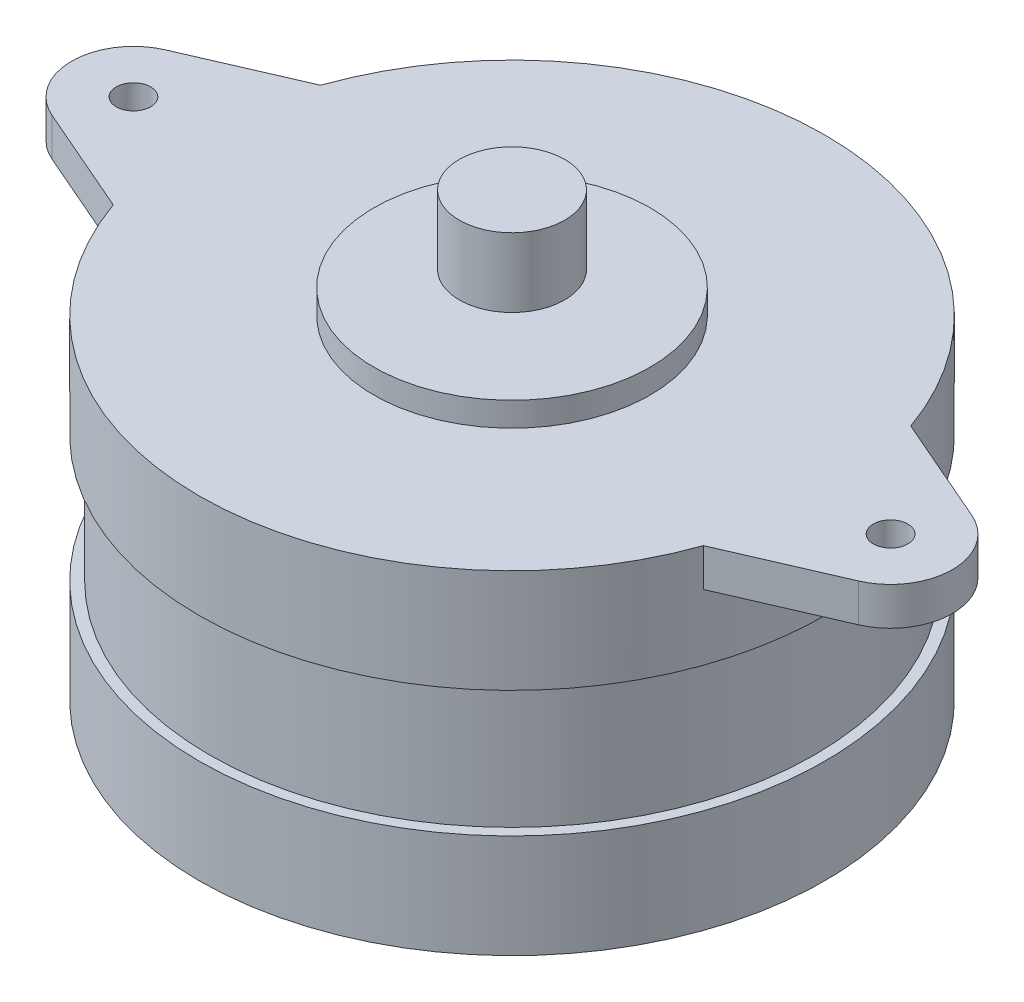
from build123d import *

# Parameters (mm, degrees)
BOSS_EXTRUDE1_START = -2.2
SKETCH2_R           = 1
BOSS_EXTRUDE1_DEPTH = 2.2


with BuildPart() as part:
    # Sketch1 → Revolve1 (revolve)
    with BuildSketch(Plane.XY, mode=Mode.PRIVATE) as revolve1_sk:
        Polygon((0, 25.6), (3.05, 25.6), (3.05, 21.6), (1.25, 21.6), (1.25, 20.7), (8, 20.7), (8, 19.3), (18.11, 19.3), (18.11, 13.3), (17.5, 13.3), (17.5, 6), (18.11, 6), (18.11, 0), (0, 0), align=None)
    revolve(revolve1_sk.sketch.rotate(Axis((0, 0, 0), (0, 1, 0)), 90), axis=Axis((0, 0, 0), (0, 1, 0)))

    # Sketch2 → Boss-Extrude1 (add)
    # profile 1 of 2: a face of its own
    with BuildSketch(Plane(origin=(0, 19.3, 0), x_dir=(1, 0, 0), z_dir=(0, 1, 0)).offset(BOSS_EXTRUDE1_START)):
        with BuildLine():
            Line((-23.3452514, 3.284061273), (-17.087191109, 6))
            ThreePointArc((-17.087191109, 6), (-18.11, 0), (-17.087191109, -6))
            Line((-17.087191109, -6), (-23.3452514, -3.284061273))
            ThreePointArc((-23.3452514, -3.284061273), (-25.5, 0), (-23.3452514, 3.284061273))
        make_face()
        with Locations(Location((-21.92, 0, 0), (0, 0, 270))):
            Circle(SKETCH2_R, mode=Mode.SUBTRACT)
    # profile 2 of 2: a face of its own
    with BuildSketch(Plane(origin=(0, 19.3, 0), x_dir=(1, 0, 0), z_dir=(0, 1, 0)).offset(BOSS_EXTRUDE1_START)):
        with BuildLine():
            Line((17.087191109, 6), (23.3452514, 3.284061273))
            ThreePointArc((23.3452514, 3.284061273), (25.5, 0), (23.3452514, -3.284061273))
            Line((23.3452514, -3.284061273), (17.087191109, -6))
            ThreePointArc((17.087191109, -6), (18.11, 0), (17.087191109, 6))
        make_face()
        with Locations(Location((21.92, 0, 0), (0, 0, 270))):
            Circle(SKETCH2_R, mode=Mode.SUBTRACT)
    extrude(amount=BOSS_EXTRUDE1_DEPTH)


solid = part.part
